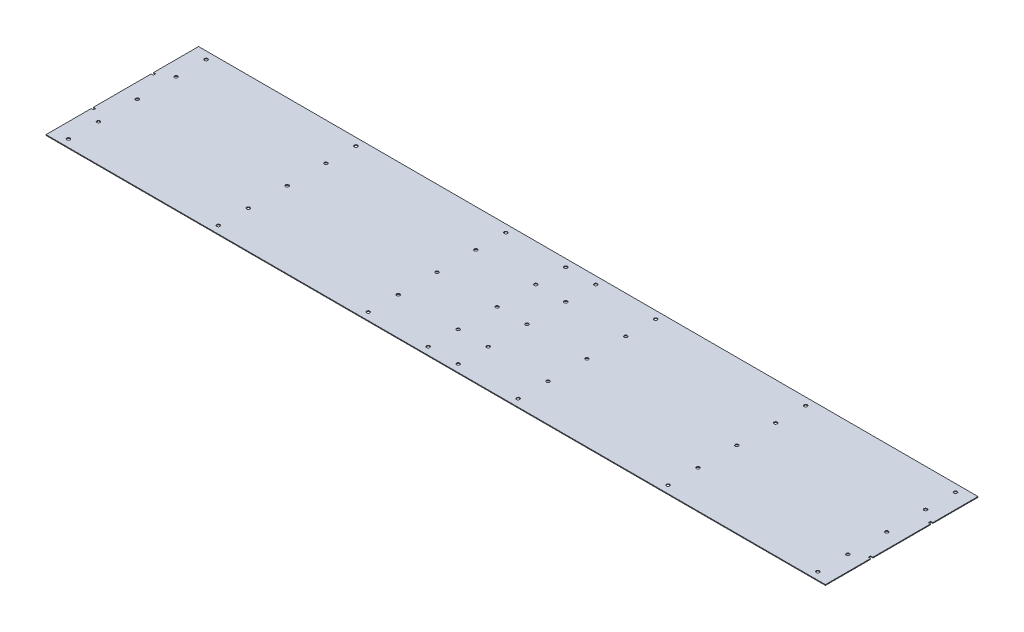
from build123d import *

# Parameters (mm, degrees)
SKETCH1_R           = 2.15
BOSS_EXTRUDE1_DEPTH = 1


with BuildPart() as part:
    # Sketch1 → Boss-Extrude1 (new body)
    with BuildSketch(Plane(origin=(0, 0, 0), x_dir=(1, 0, 0), z_dir=(0, 1, 0))):
        Polygon((-20, -41.5), (-20, -101.8), (1020, -101.8), (1020, -41.5), (1017, -41.5), (1017, -38.5), (1020, -38.5), (1020, 38.5), (1017, 38.5), (1017, 41.5), (1020, 41.5), (1020, 101.8), (-20, 101.8), (-20, 41.5), (-17, 41.5), (-17, 38.5), (-20, 38.5), (-20, -38.5), (-17, -38.5), (-17, -41.5), align=None)
        with Locations(Location((0, -51.8, 0), (0, 0, 270))):
            Circle(SKETCH1_R, mode=Mode.SUBTRACT)
        with Locations(Location((0, 51.8, 0), (0, 0, 270))):
            Circle(SKETCH1_R, mode=Mode.SUBTRACT)
        with Locations(Location((0, -91.8, 0), (0, 0, 270))):
            Circle(SKETCH1_R, mode=Mode.SUBTRACT)
        with Locations(Location((0, 91.8, 0), (0, 0, 270))):
            Circle(SKETCH1_R, mode=Mode.SUBTRACT)
        with Locations(Location((200, -91.8, 0), (0, 0, 270))):
            Circle(SKETCH1_R, mode=Mode.SUBTRACT)
        with Locations(Location((200, -51.8, 0), (0, 0, 270))):
            Circle(SKETCH1_R, mode=Mode.SUBTRACT)
        with Locations(Location((200, 51.8, 0), (0, 0, 270))):
            Circle(SKETCH1_R, mode=Mode.SUBTRACT)
        with Locations(Location((200, 91.8, 0), (0, 0, 270))):
            Circle(SKETCH1_R, mode=Mode.SUBTRACT)
        with Locations(Location((0, 0, 0), (0, 0, 270))):
            Circle(SKETCH1_R, mode=Mode.SUBTRACT)
        with Locations(Location((480, 0, 0), (0, 0, 270))):
            Circle(SKETCH1_R, mode=Mode.SUBTRACT)
        with Locations(Location((200, 0, 0), (0, 0, 270))):
            Circle(SKETCH1_R, mode=Mode.SUBTRACT)
        with Locations(Location((480, 91.8, 0), (0, 0, 270))):
            Circle(SKETCH1_R, mode=Mode.SUBTRACT)
        with Locations(Location((480, 51.8, 0), (0, 0, 270))):
            Circle(SKETCH1_R, mode=Mode.SUBTRACT)
        with Locations(Location((480, -51.8, 0), (0, 0, 270))):
            Circle(SKETCH1_R, mode=Mode.SUBTRACT)
        with Locations(Location((480, -91.8, 0), (0, 0, 270))):
            Circle(SKETCH1_R, mode=Mode.SUBTRACT)
        with Locations(Location((400, -91.8, 0), (0, 0, 270))):
            Circle(SKETCH1_R, mode=Mode.SUBTRACT)
        with Locations(Location((400, -51.8, 0), (0, 0, 270))):
            Circle(SKETCH1_R, mode=Mode.SUBTRACT)
        with Locations(Location((400, 51.8, 0), (0, 0, 270))):
            Circle(SKETCH1_R, mode=Mode.SUBTRACT)
        with Locations(Location((400, 91.8, 0), (0, 0, 270))):
            Circle(SKETCH1_R, mode=Mode.SUBTRACT)
        with Locations(Location((600, -91.8, 0), (0, 0, 270))):
            Circle(SKETCH1_R, mode=Mode.SUBTRACT)
        with Locations(Location((600, -51.8, 0), (0, 0, 270))):
            Circle(SKETCH1_R, mode=Mode.SUBTRACT)
        with Locations(Location((600, 51.8, 0), (0, 0, 270))):
            Circle(SKETCH1_R, mode=Mode.SUBTRACT)
        with Locations(Location((600, 91.8, 0), (0, 0, 270))):
            Circle(SKETCH1_R, mode=Mode.SUBTRACT)
        with Locations(Location((800, -91.8, 0), (0, 0, 270))):
            Circle(SKETCH1_R, mode=Mode.SUBTRACT)
        with Locations(Location((800, -51.8, 0), (0, 0, 270))):
            Circle(SKETCH1_R, mode=Mode.SUBTRACT)
        with Locations(Location((800, 51.8, 0), (0, 0, 270))):
            Circle(SKETCH1_R, mode=Mode.SUBTRACT)
        with Locations(Location((800, 91.8, 0), (0, 0, 270))):
            Circle(SKETCH1_R, mode=Mode.SUBTRACT)
        with Locations(Location((1000, -91.8, 0), (0, 0, 270))):
            Circle(SKETCH1_R, mode=Mode.SUBTRACT)
        with Locations(Location((1000, -51.8, 0), (0, 0, 270))):
            Circle(SKETCH1_R, mode=Mode.SUBTRACT)
        with Locations(Location((1000, 51.8, 0), (0, 0, 270))):
            Circle(SKETCH1_R, mode=Mode.SUBTRACT)
        with Locations(Location((1000, 91.8, 0), (0, 0, 270))):
            Circle(SKETCH1_R, mode=Mode.SUBTRACT)
        with Locations(Location((520, -91.8, 0), (0, 0, 270))):
            Circle(SKETCH1_R, mode=Mode.SUBTRACT)
        with Locations(Location((520, -51.8, 0), (0, 0, 270))):
            Circle(SKETCH1_R, mode=Mode.SUBTRACT)
        with Locations(Location((520, 0, 0), (0, 0, 270))):
            Circle(SKETCH1_R, mode=Mode.SUBTRACT)
        with Locations(Location((520, 51.8, 0), (0, 0, 270))):
            Circle(SKETCH1_R, mode=Mode.SUBTRACT)
        with Locations(Location((520, 91.8, 0), (0, 0, 270))):
            Circle(SKETCH1_R, mode=Mode.SUBTRACT)
        with Locations(Location((600, 0, 0), (0, 0, 270))):
            Circle(SKETCH1_R, mode=Mode.SUBTRACT)
        with Locations(Location((800, 0, 0), (0, 0, 270))):
            Circle(SKETCH1_R, mode=Mode.SUBTRACT)
        with Locations(Location((1000, 0, 0), (0, 0, 270))):
            Circle(SKETCH1_R, mode=Mode.SUBTRACT)
        with Locations(Location((400, 0, 0), (0, 0, 270))):
            Circle(SKETCH1_R, mode=Mode.SUBTRACT)
    extrude(amount=BOSS_EXTRUDE1_DEPTH)


solid = part.part
